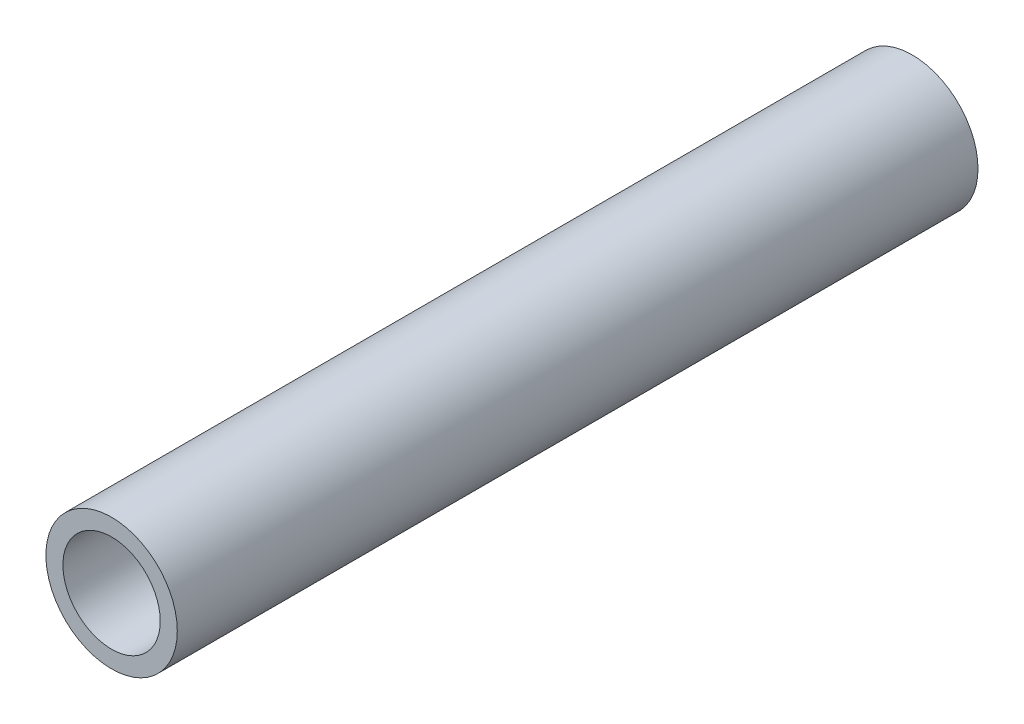
from build123d import *

# Parameters (mm, degrees)
SKETCH1_R           = 10.668
SKETCH1_R_2         = 7.8994
EXTRUDE_THIN1_DEPTH = 65


with BuildPart() as part:
    # Sketch1 → Extrude-Thin1 (new, symmetric)
    with BuildSketch(Plane.XY):
        Circle(SKETCH1_R)
        Circle(SKETCH1_R_2, mode=Mode.SUBTRACT)
    extrude(amount=EXTRUDE_THIN1_DEPTH, both=True)


solid = part.part
